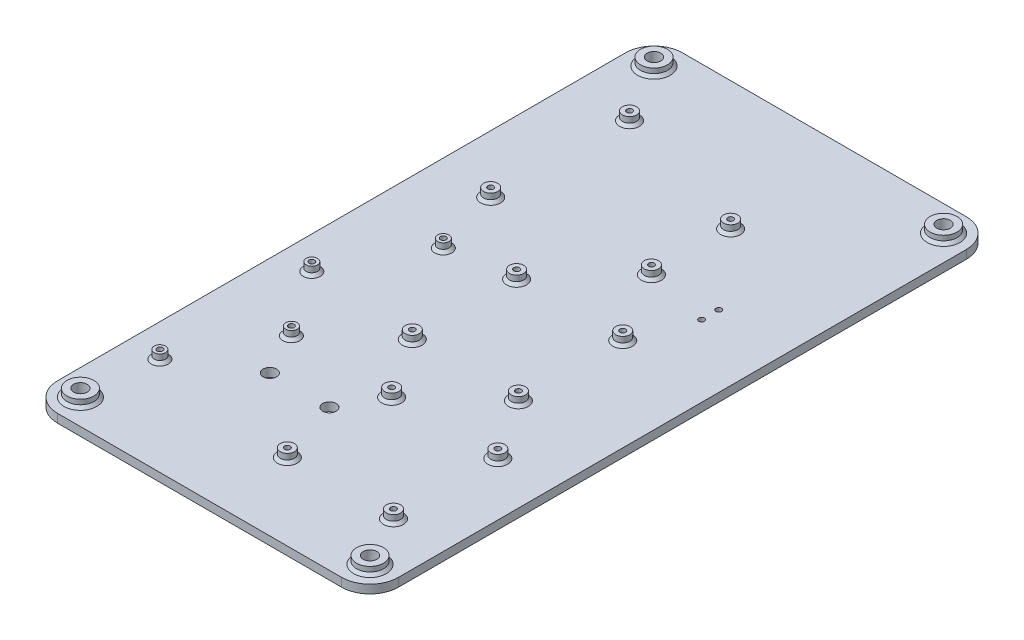
from build123d import *

# Parameters (mm, degrees)
BOSS_EXTRUDE1_DEPTH        = 1.5
SKETCH3_R                  = 2.5
SKETCH3_R_2                = 1
SKETCH3_R_3                = 2
BOSS_EXTRUDE2_DEPTH        = 3
F_4_8_4_8_DIAMETER_HOLE1_D = 4.8
SKETCH7_R                  = 4.75
SKETCH7_R_2                = 2.4
BOSS_EXTRUDE3_DEPTH        = 2.7
F_2_0MM_DOWEL_HOLE1_D      = 2
CHAMFER1_SIZE              = 1
SKETCH15_R                 = 2.38125
CUT_EXTRUDE1_DEPTH         = 126.335549626


with BuildPart() as part:
    # Sketch2 → Boss-Extrude1 (new, symmetric)
    with BuildSketch(Plane(origin=(0, 0, 0), x_dir=(1, 0, 0), z_dir=(0, 1, 0))):
        with BuildLine():
            Line((-50, -110), (50, -110))
            ThreePointArc((50, -110), (57.071067812, -107.071067812), (60, -100))
            Line((60, -100), (60, 100))
            ThreePointArc((60, 100), (57.071067812, 107.071067812), (50, 110))
            Line((50, 110), (-50, 110))
            ThreePointArc((-50, 110), (-57.071067812, 107.071067812), (-60, 100))
            Line((-60, 100), (-60, -100))
            ThreePointArc((-60, -100), (-57.071067812, -107.071067812), (-50, -110))
        make_face()
    extrude(amount=BOSS_EXTRUDE1_DEPTH, both=True)

    # Sketch3 → Boss-Extrude2 (add)
    # profile 1 of 16: a face of its own
    with BuildSketch(Plane(origin=(0, 1.5, 0), x_dir=(1, 0, 0), z_dir=(0, 1, 0))):
        with Locations(Location((41.24318761, -46.24391141, 0), (0, 0, 90))):
            Circle(SKETCH3_R)
        with Locations(Location((41.24318761, -46.24391141, 0), (0, 0, 270))):
            Circle(SKETCH3_R_2, mode=Mode.SUBTRACT)
    # profile 2 of 16: a face of its own
    with BuildSketch(Plane(origin=(0, 1.5, 0), x_dir=(1, 0, 0), z_dir=(0, 1, 0))):
        with Locations(Location((3.86368673, -46.24391141, 0), (0, 0, 90))):
            Circle(SKETCH3_R)
        with Locations(Location((3.86368673, -46.24391141, 0), (0, 0, 270))):
            Circle(SKETCH3_R_2, mode=Mode.SUBTRACT)
    # profile 3 of 16: a face of its own
    with BuildSketch(Plane(origin=(0, 1.5, 0), x_dir=(1, 0, 0), z_dir=(0, 1, 0))):
        with Locations(Location((3.86368673, -82.98571173, 0), (0, 0, 90))):
            Circle(SKETCH3_R)
        with Locations(Location((3.86368673, -82.98571173, 0), (0, 0, 270))):
            Circle(SKETCH3_R_2, mode=Mode.SUBTRACT)
    # profile 4 of 16: a face of its own
    with BuildSketch(Plane(origin=(0, 1.5, 0), x_dir=(1, 0, 0), z_dir=(0, 1, 0))):
        with Locations(Location((41.24318761, -82.98571173, 0), (0, 0, 90))):
            Circle(SKETCH3_R)
        with Locations(Location((41.24318761, -82.98571173, 0), (0, 0, 270))):
            Circle(SKETCH3_R_2, mode=Mode.SUBTRACT)
    # profile 5 of 16: a face of its own
    with BuildSketch(Plane(origin=(0, 1.5, 0), x_dir=(1, 0, 0), z_dir=(0, 1, 0))):
        with Locations(Location((-10.13631327, -24.98571173, 0), (0, 0, 90))):
            Circle(SKETCH3_R)
        with Locations(Location((-10.13631327, -24.98571173, 0), (0, 0, 270))):
            Circle(SKETCH3_R_2, mode=Mode.SUBTRACT)
    # profile 6 of 16: a face of its own
    with BuildSketch(Plane(origin=(0, 1.5, 0), x_dir=(1, 0, 0), z_dir=(0, 1, 0))):
        with Locations(Location((-10.13631327, 11.75608859, 0), (0, 0, 90))):
            Circle(SKETCH3_R)
        with Locations(Location((-10.13631327, 11.75608859, 0), (0, 0, 270))):
            Circle(SKETCH3_R_2, mode=Mode.SUBTRACT)
    # profile 7 of 16: a face of its own
    with BuildSketch(Plane(origin=(0, 1.5, 0), x_dir=(1, 0, 0), z_dir=(0, 1, 0))):
        with Locations(Location((27.24318761, 11.75608859, 0), (0, 0, 90))):
            Circle(SKETCH3_R)
        with Locations(Location((27.24318761, 11.75608859, 0), (0, 0, 270))):
            Circle(SKETCH3_R_2, mode=Mode.SUBTRACT)
    # profile 8 of 16: a face of its own
    with BuildSketch(Plane(origin=(0, 1.5, 0), x_dir=(1, 0, 0), z_dir=(0, 1, 0))):
        with Locations(Location((27.24318761, -24.98571173, 0), (0, 0, 90))):
            Circle(SKETCH3_R)
        with Locations(Location((27.24318761, -24.98571173, 0), (0, 0, 270))):
            Circle(SKETCH3_R_2, mode=Mode.SUBTRACT)
    # profile 9 of 16: a face of its own
    with BuildSketch(Plane(origin=(0, 1.5, 0), x_dir=(1, 0, 0), z_dir=(0, 1, 0))):
        with Locations(Location((-48.56, -75.45, 0), (0, 0, 90))):
            Circle(SKETCH3_R_3)
        with Locations(Location((-48.56, -75.45, 0), (0, 0, 270))):
            Circle(SKETCH3_R_2, mode=Mode.SUBTRACT)
    # profile 10 of 16: a face of its own
    with BuildSketch(Plane(origin=(0, 1.5, 0), x_dir=(1, 0, 0), z_dir=(0, 1, 0))):
        with Locations(Location((-32.54, -45.15, 0), (0, 0, 90))):
            Circle(SKETCH3_R_3)
        with Locations(Location((-32.54, -45.15, 0), (0, 0, 270))):
            Circle(SKETCH3_R_2, mode=Mode.SUBTRACT)
    # profile 11 of 16: a face of its own
    with BuildSketch(Plane(origin=(0, 1.5, 0), x_dir=(1, 0, 0), z_dir=(0, 1, 0))):
        with Locations(Location((-48.56, -21.95, 0), (0, 0, 90))):
            Circle(SKETCH3_R_3)
        with Locations(Location((-48.56, -21.95, 0), (0, 0, 270))):
            Circle(SKETCH3_R_2, mode=Mode.SUBTRACT)
    # profile 12 of 16: a face of its own
    with BuildSketch(Plane(origin=(0, 1.5, 0), x_dir=(1, 0, 0), z_dir=(0, 1, 0))):
        with Locations(Location((-32.54, 8.35, 0), (0, 0, 90))):
            Circle(SKETCH3_R_3)
        with Locations(Location((-32.54, 8.35, 0), (0, 0, 270))):
            Circle(SKETCH3_R_2, mode=Mode.SUBTRACT)
    # profile 13 of 16: a face of its own
    with BuildSketch(Plane(origin=(0, 1.5, 0), x_dir=(1, 0, 0), z_dir=(0, 1, 0))):
        with Locations(Location((-39.7, 32.2, 0), (0, 0, 90))):
            Circle(SKETCH3_R)
        with Locations(Location((-39.7, 32.2, 0), (0, 0, 270))):
            Circle(SKETCH3_R_2, mode=Mode.SUBTRACT)
    # profile 14 of 16: a face of its own
    with BuildSketch(Plane(origin=(0, 1.5, 0), x_dir=(1, 0, 0), z_dir=(0, 1, 0))):
        with Locations(Location((-38.6, 80, 0), (0, 0, 90))):
            Circle(SKETCH3_R)
        with Locations(Location((-38.6, 80, 0), (0, 0, 270))):
            Circle(SKETCH3_R_2, mode=Mode.SUBTRACT)
    # profile 15 of 16: a face of its own
    with BuildSketch(Plane(origin=(0, 1.5, 0), x_dir=(1, 0, 0), z_dir=(0, 1, 0))):
        with Locations(Location((12.2, 36.9, 0), (0, 0, 90))):
            Circle(SKETCH3_R)
        with Locations(Location((12.2, 36.9, 0), (0, 0, 270))):
            Circle(SKETCH3_R_2, mode=Mode.SUBTRACT)
    # profile 16 of 16: a face of its own
    with BuildSketch(Plane(origin=(0, 1.5, 0), x_dir=(1, 0, 0), z_dir=(0, 1, 0))):
        with Locations(Location((12.2, 64.8, 0), (0, 0, 90))):
            Circle(SKETCH3_R)
        with Locations(Location((12.2, 64.8, 0), (0, 0, 270))):
            Circle(SKETCH3_R_2, mode=Mode.SUBTRACT)
    extrude(amount=BOSS_EXTRUDE2_DEPTH)

    # Ø4.8 (4.8) Diameter Hole1 (through all)
    with Locations(Plane(origin=(0, 1.5, 0), x_dir=(1, 0, 0), z_dir=(0, 1, 0))):
        with Locations((51, 101), (51, -101), (-51, -101), (-51, 101)):
            Hole(F_4_8_4_8_DIAMETER_HOLE1_D / 2)

    # Sketch7 → Boss-Extrude3 (add)
    # profile 1 of 4: a face of its own
    with BuildSketch(Plane(origin=(0, 1.5, 0), x_dir=(1, 0, 0), z_dir=(0, 1, 0))):
        with Locations(Location((51, 101, 0), (0, 0, 90))):
            Circle(SKETCH7_R)
        with Locations(Location((51, 101, 0), (0, 0, 270))):
            Circle(SKETCH7_R_2, mode=Mode.SUBTRACT)
    # profile 2 of 4: a face of its own
    with BuildSketch(Plane(origin=(0, 1.5, 0), x_dir=(1, 0, 0), z_dir=(0, 1, 0))):
        with Locations(Location((-51, 101, 0), (0, 0, 90))):
            Circle(SKETCH7_R)
        with Locations(Location((-51, 101, 0), (0, 0, 270))):
            Circle(SKETCH7_R_2, mode=Mode.SUBTRACT)
    # profile 3 of 4: a face of its own
    with BuildSketch(Plane(origin=(0, 1.5, 0), x_dir=(1, 0, 0), z_dir=(0, 1, 0))):
        with Locations(Location((-51, -101, 0), (0, 0, 90))):
            Circle(SKETCH7_R)
        with Locations(Location((-51, -101, 0), (0, 0, 270))):
            Circle(SKETCH7_R_2, mode=Mode.SUBTRACT)
    # profile 4 of 4: a face of its own
    with BuildSketch(Plane(origin=(0, 1.5, 0), x_dir=(1, 0, 0), z_dir=(0, 1, 0))):
        with Locations(Location((51, -101, 0), (0, 0, 90))):
            Circle(SKETCH7_R)
        with Locations(Location((51, -101, 0), (0, 0, 270))):
            Circle(SKETCH7_R_2, mode=Mode.SUBTRACT)
    extrude(amount=BOSS_EXTRUDE3_DEPTH)

    # Ø2.0mm Dowel Hole1 (through all)
    with Locations(Plane(origin=(0, 1.5, 0), x_dir=(1, 0, 0), z_dir=(0, 1, 0))):
        with Locations((27.24318761, -24.98571173), (27.24318761, 11.75608859), (-10.13631327, -24.98571173), (-10.13631327, 11.75608859), (3.86368673, -46.24391141), (41.24318761, -46.24391141), (41.24318761, -82.98571173), (3.86368673, -82.98571173), (12.2, 36.9), (12.2, 64.8), (-38.6, 80), (-39.7, 32.2), (-32.54, 8.35), (-48.56, -21.95), (-48.56, -75.45), (-32.54, -45.15), (34.8, 38), (34.8, 32)):
            Hole(F_2_0MM_DOWEL_HOLE1_D / 2)

    # Chamfer1
    chamfer1_edges = [part.edges().sort_by_distance(p)[0] for p in [
        (-38.6, 1.5, -77.5),
        (12.2, 1.5, -34.4),
        (12.2, 1.5, -62.3),
        (51, 1.5, -96.25),
        (-51, 1.5, -96.25),
        (-51, 1.5, 105.75),
        (51, 1.5, 105.75),
        (41.24318761, 1.5, 48.74391141),
        (3.86368673, 1.5, 48.74391141),
        (3.86368673, 1.5, 85.48571173),
        (41.24318761, 1.5, 85.48571173),
        (-10.13631327, 1.5, 27.48571173),
        (-10.13631327, 1.5, -9.25608859),
        (27.24318761, 1.5, -9.25608859),
        (27.24318761, 1.5, 27.48571173),
        (-48.56, 1.5, 77.45),
        (-32.54, 1.5, 47.15),
        (-48.56, 1.5, 23.95),
        (-32.54, 1.5, -6.35),
        (-39.7, 1.5, -29.7),
    ]]
    chamfer(chamfer1_edges, length=CHAMFER1_SIZE)

    # Sketch15 → Cut-Extrude1 (cut, through all)
    with BuildSketch(Plane(origin=(0, 1.5, 0), x_dir=(1, 0, 0), z_dir=(0, 1, 0))):
        with Locations(Location((-4, -60.3, 0), (0, 0, 270))):
            Circle(SKETCH15_R)
        with Locations(Location((-25, -60.3, 0), (0, 0, 270))):
            Circle(SKETCH15_R)
    extrude(amount=-CUT_EXTRUDE1_DEPTH, mode=Mode.SUBTRACT)


solid = part.part
